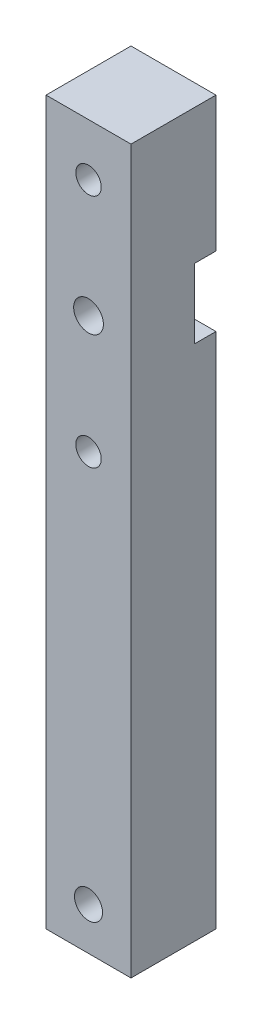
from build123d import *

# Parameters (mm, degrees)
SKETCH1_W               = 10
SKETCH1_H               = 10
BOSS_EXTRUDE1_DEPTH     = 85
CUT_EXTRUDE1_DEPTH      = 2.5
SKETCH3_R               = 1.75
CUT_EXTRUDE2_DEPTH      = 86.914201387
CUT_EXTRUDE3_DEPTH      = 2.5
CUT_EXTRUDE3_DEPTH_BACK = 86.914201387
SKETCH4_R               = 1.5
SKETCH5_R               = 1.65
CUT_EXTRUDE4_DEPTH      = 87.168439698


with BuildPart() as part:
    # Sketch1 → Boss-Extrude1 (new body)
    with BuildSketch(Plane(origin=(0, 0, 0), x_dir=(1, 0, 0), z_dir=(0, 1, 0))):
        with Locations((5, 5)):
            Rectangle(SKETCH1_W, SKETCH1_H)
    extrude(amount=BOSS_EXTRUDE1_DEPTH)

    # Sketch2 → Cut-Extrude1 (cut)
    with BuildSketch(Plane(origin=(0, 0, -10), x_dir=(-1, 0, 0), z_dir=(0, 0, -1))):
        Polygon((0, 60.9), (0, 69.1), (-5, 69.1), (-10, 69.1), (-10, 60.9), align=None)
    extrude(amount=-CUT_EXTRUDE1_DEPTH, mode=Mode.SUBTRACT)

    # Sketch3 → Cut-Extrude2 (cut, through all)
    with BuildSketch(Plane(origin=(0, 0, -7.5), x_dir=(-1, 0, 0), z_dir=(0, 0, -1))):
        with Locations((-5, 65)):
            Circle(SKETCH3_R)
    extrude(amount=-CUT_EXTRUDE2_DEPTH, mode=Mode.SUBTRACT)

    # Sketch4 → Cut-Extrude3 (cut, two sides: drawn at the far end of the back side and taken through both)
    with BuildSketch(Plane(origin=(0, 0, -7.5), x_dir=(-1, 0, 0), z_dir=(0, 0, -1)).offset(-CUT_EXTRUDE3_DEPTH_BACK)):
        with Locations((-5, 78.856)):
            Circle(SKETCH4_R)
        with Locations((-5, 51.144)):
            Circle(SKETCH4_R)
    extrude(amount=CUT_EXTRUDE3_DEPTH + CUT_EXTRUDE3_DEPTH_BACK, mode=Mode.SUBTRACT)

    # Sketch5 → Cut-Extrude4 (cut, through all)
    with BuildSketch(Plane.XY):
        with Locations((5, 5)):
            Circle(SKETCH5_R)
    extrude(amount=-CUT_EXTRUDE4_DEPTH, mode=Mode.SUBTRACT)


solid = part.part
